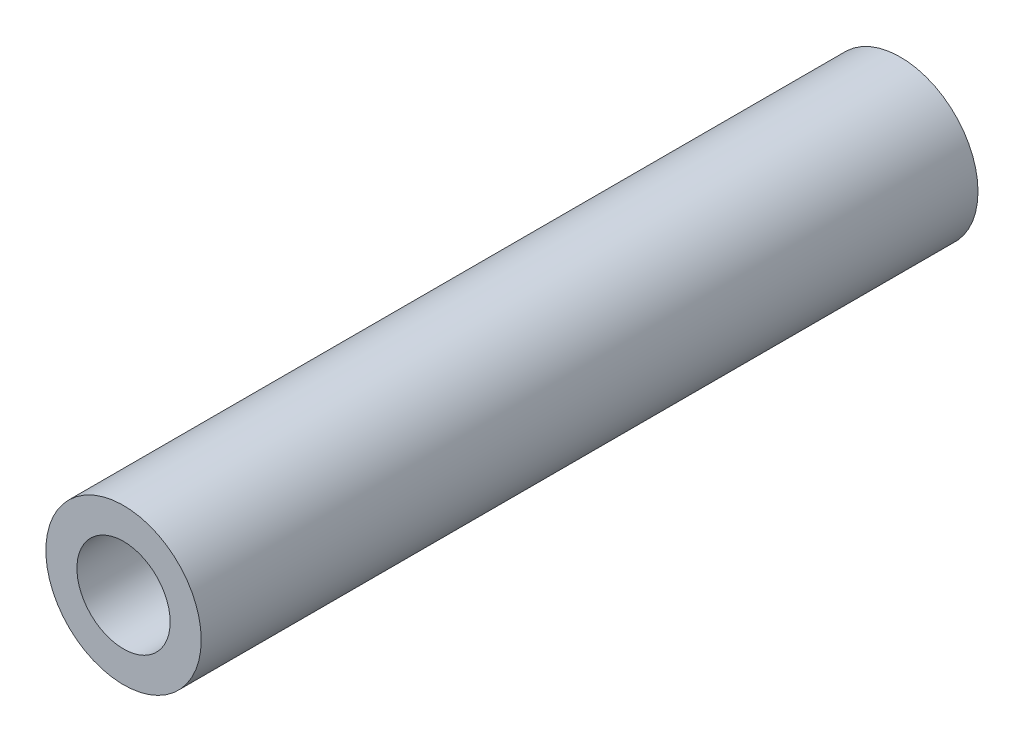
from build123d import *

# Parameters (mm, degrees)
CROQUIS1_R              = 2.5
CROQUIS1_R_2            = 1.5
SALIENTE_EXTRUIR1_DEPTH = 25


with BuildPart() as part:
    # Croquis1 → Saliente-Extruir1 (new body)
    with BuildSketch(Plane.XY):
        Circle(CROQUIS1_R)
        Circle(CROQUIS1_R_2, mode=Mode.SUBTRACT)
    extrude(amount=SALIENTE_EXTRUIR1_DEPTH)


solid = part.part
